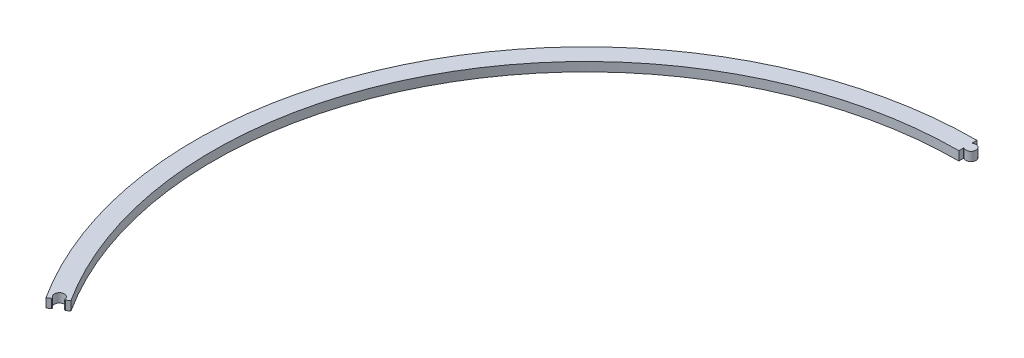
from build123d import *

# Parameters (mm, degrees)
BOSS_EXTRUDE1_DEPTH = 2.5
FILLET1_R           = 0.2
FILLET2_R           = 0.1


with BuildPart() as part:
    # Sketch1 → Boss-Extrude1 (new body)
    with BuildSketch(Plane(origin=(0, 0, 0), x_dir=(1, 0, 0), z_dir=(0, 1, 0))):
        with BuildLine():
            Line((0, 103.6), (0, 105.039339828))
            ThreePointArc((0, 105.039339828), (2.25, 106.1), (0, 107.160660172))
            Line((0, 107.160660172), (0, 108.6))
            ThreePointArc((0, 108.6), (-95.275317005, 52.120763325), (-91.451606784, -58.571013451))
            Line((-91.451606784, -58.571013451), (-90.239544721, -57.794737277))
            ThreePointArc((-90.239544721, -57.794737277), (-90.559855065, -55.32797801), (-88.453189713, -56.650649963))
            Line((-88.453189713, -56.650649963), (-87.24112765, -55.874373789))
            ThreePointArc((-87.24112765, -55.874373789), (-90.888792281, 49.721096506), (0, 103.6))
        make_face()
    extrude(amount=BOSS_EXTRUDE1_DEPTH)

    # Fillet1
    fillet1_edges = [part.edges().sort_by_distance(p)[0] for p in [
        (-88.453189713, 1.25, 56.650649963),
        (-90.239544721, 1.25, 57.794737277),
    ]]
    fillet(fillet1_edges, radius=FILLET1_R)

    # Fillet2
    fillet2_edges = [part.edges().sort_by_distance(p)[0] for p in [
        (0, 1.25, -107.160660172),
        (0, 1.25, -105.039339828),
    ]]
    fillet(fillet2_edges, radius=FILLET2_R)


solid = part.part
